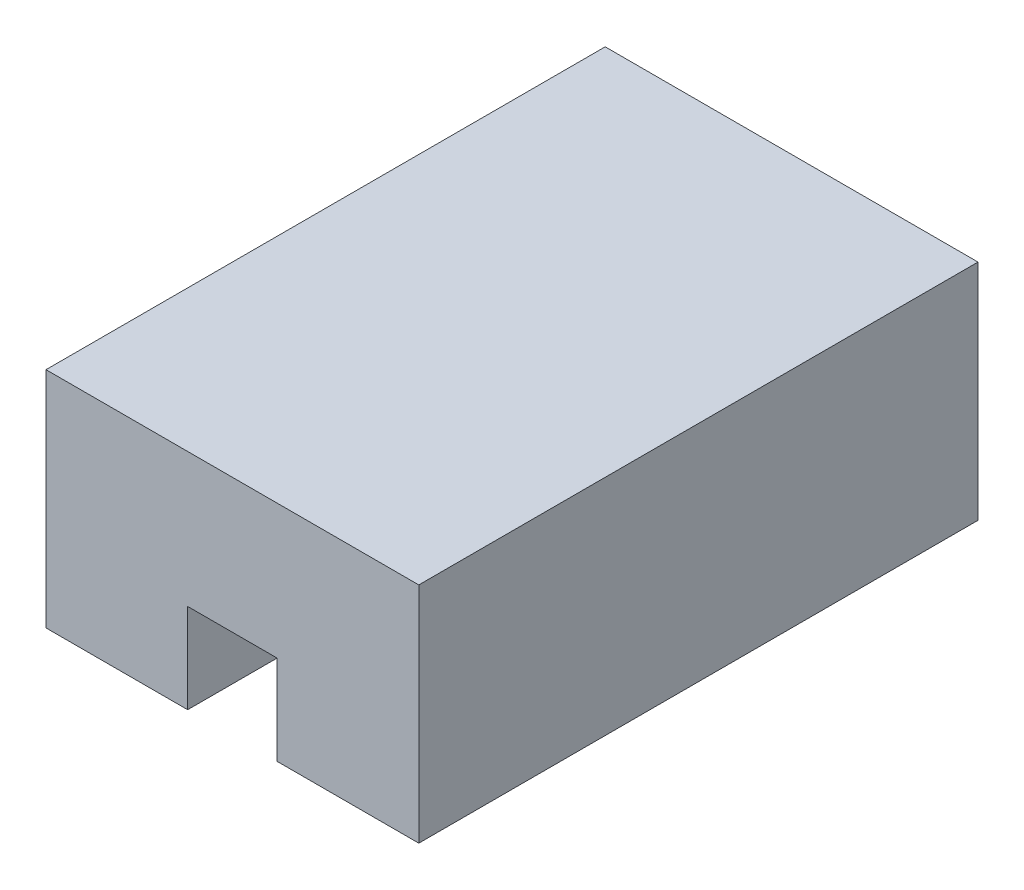
from build123d import *

# Parameters (mm, degrees)
SALIENTE_EXTRUIR1_DEPTH = 75


with BuildPart() as part:
    # Croquis1 → Saliente-Extruir1 (new body)
    with BuildSketch(Plane.XY):
        Polygon((0, 0), (50, 0), (50, -30), (31, -30), (31, -18), (19, -18), (19, -30), (0, -30), align=None)
    extrude(amount=SALIENTE_EXTRUIR1_DEPTH)


solid = part.part
